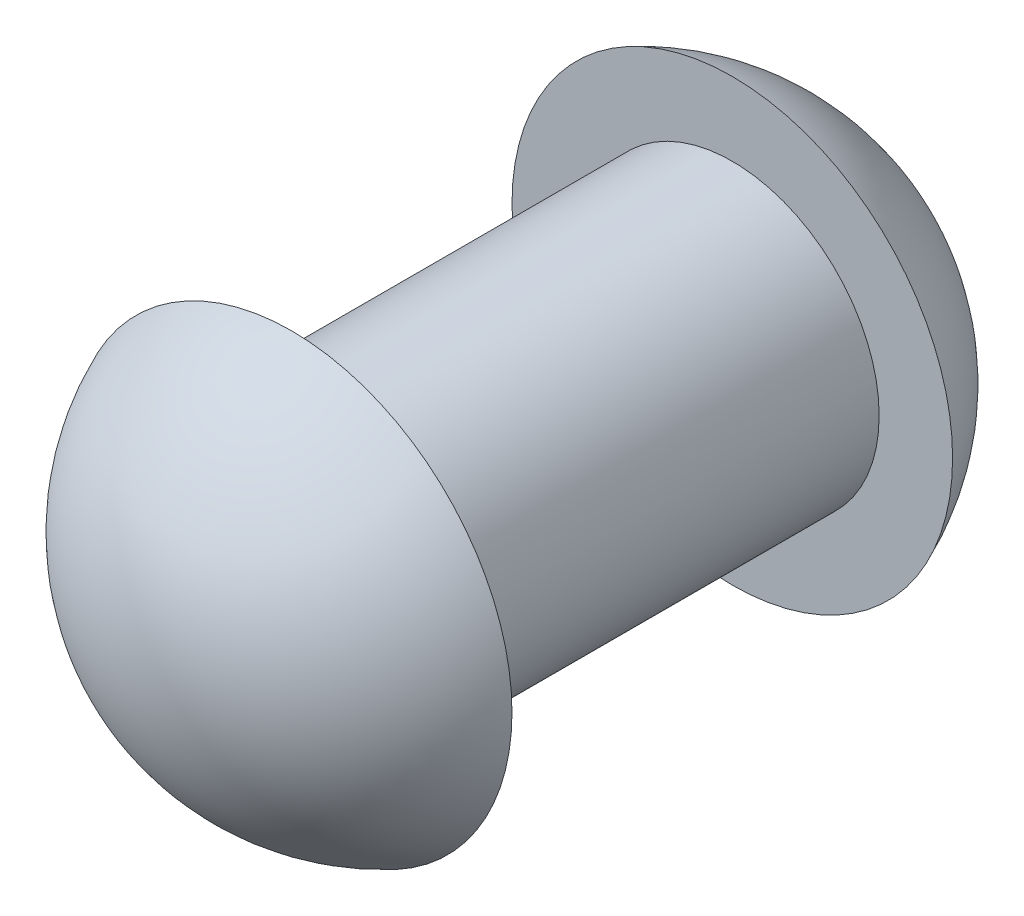
from build123d import *


with BuildPart() as part:
    # 草图1 → 旋转1 (revolve)
    with BuildSketch(Plane(origin=(0, 0, 0), x_dir=(1, 0, 0), z_dir=(0, 1, 0)), mode=Mode.PRIVATE) as revolve_1_sk:
        with BuildLine():
            Line((0, 2.5), (0, -2.5))
            ThreePointArc((0, -2.5), (0.901387819, -2.227081728), (1.5, -1.5))
            Line((1.5, -1.5), (1, -1.5))
            Line((1, -1.5), (1, 1.5))
            Line((1, 1.5), (1.5, 1.5))
            ThreePointArc((1.5, 1.5), (0.901387819, 2.227081728), (0, 2.5))
        make_face()
    revolve(revolve_1_sk.sketch.rotate(Axis((0, 0, -2.5), (0, 0, 1)), 180), axis=Axis((0, 0, -2.5), (0, 0, 1)))


solid = part.part
